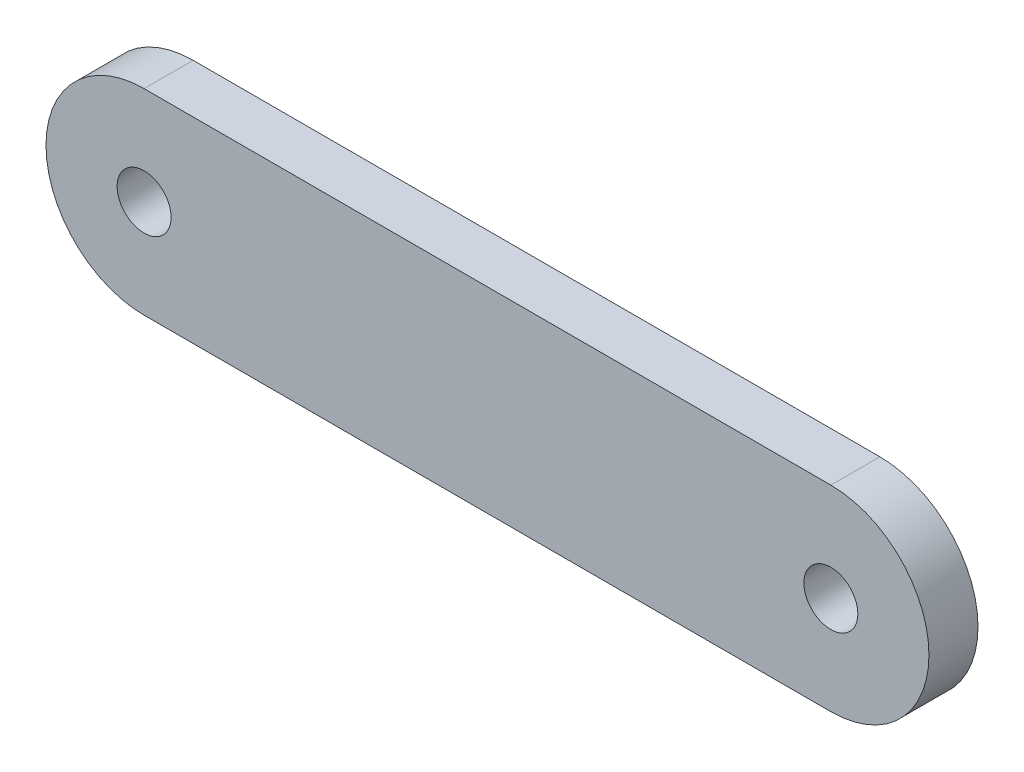
from build123d import *

# Parameters (mm, degrees)
SKETCH1_R           = 5.5
BOSS_EXTRUDE1_DEPTH = 10


with BuildPart() as part:
    # Sketch1 → Boss-Extrude1 (new body)
    with BuildSketch(Plane.XY):
        with BuildLine():
            Line((0, 0), (140, 0))
            ThreePointArc((140, 0), (160, 20), (140, 40))
            Line((140, 40), (0, 40))
            ThreePointArc((0, 40), (-20, 20), (0, 0))
        make_face()
        with Locations((0, 20)):
            Circle(SKETCH1_R, mode=Mode.SUBTRACT)
        with Locations((140, 20)):
            Circle(SKETCH1_R, mode=Mode.SUBTRACT)
    extrude(amount=BOSS_EXTRUDE1_DEPTH)


solid = part.part
